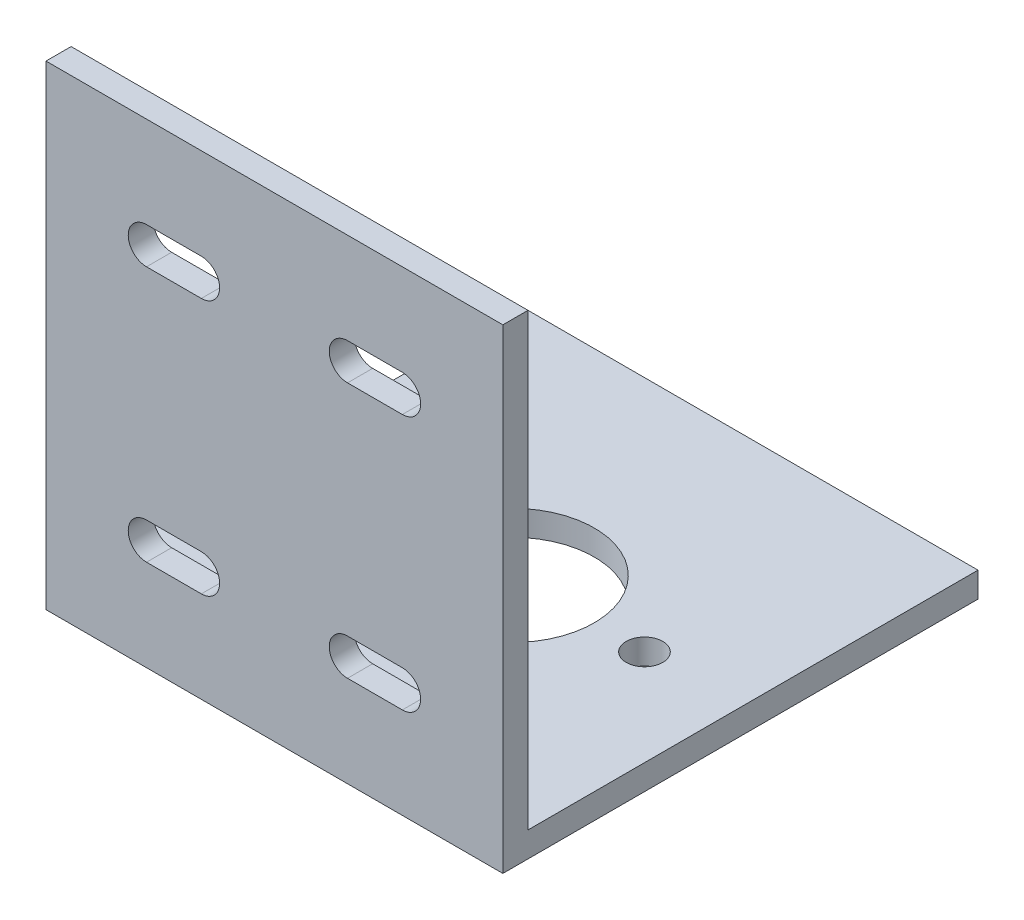
from build123d import *

# Parameters (mm, degrees)
SKETCH1_W           = 50
SKETCH1_H           = 52
SKETCH1_R           = 9
SKETCH1_R_2         = 2
BOSS_EXTRUDE1_DEPTH = 2.75
SKETCH2_W           = 50
SKETCH2_H           = 2.75
BOSS_EXTRUDE2_DEPTH = 52
CUT_EXTRUDE1_DEPTH  = 78.672388917


with BuildPart() as part:
    # Sketch1 → Boss-Extrude1 (new body)
    with BuildSketch(Plane(origin=(0, 0, 0), x_dir=(1, 0, 0), z_dir=(0, 1, 0))):
        Rectangle(SKETCH1_W, SKETCH1_H)
        with Locations(Location((0, 0, 0), (0, 0, 270))):
            Circle(SKETCH1_R, mode=Mode.SUBTRACT)
        with Locations(Location((-14.5, 0, 0), (0, 0, 270))):
            Circle(SKETCH1_R_2, mode=Mode.SUBTRACT)
        with Locations(Location((14.5, 0, 0), (0, 0, 270))):
            Circle(SKETCH1_R_2, mode=Mode.SUBTRACT)
    extrude(amount=BOSS_EXTRUDE1_DEPTH)

    # Sketch2 → Boss-Extrude2 (add)
    with BuildSketch(Plane(origin=(0, 0, 0), x_dir=(1, 0, 0), z_dir=(0, 1, 0))):
        with Locations((0, -24.625)):
            Rectangle(SKETCH2_W, SKETCH2_H)
    extrude(amount=BOSS_EXTRUDE2_DEPTH)

    # Sketch4 → Cut-Extrude1 (cut, through all)
    with BuildSketch(Plane.XY.offset(26)):
        with BuildLine():
            Line((-14, 14), (-8, 14))
            ThreePointArc((-8, 14), (-6, 12), (-8, 10))
            Line((-8, 10), (-14, 10))
            ThreePointArc((-14, 10), (-16, 12), (-14, 14))
        make_face()
        with BuildLine():
            Line((8, 14), (14, 14))
            ThreePointArc((14, 14), (16, 12), (14, 10))
            Line((14, 10), (8, 10))
            ThreePointArc((8, 10), (6, 12), (8, 14))
        make_face()
        with BuildLine():
            Line((8, 42), (14, 42))
            ThreePointArc((14, 42), (16, 40), (14, 38))
            Line((14, 38), (8, 38))
            ThreePointArc((8, 38), (6, 40), (8, 42))
        make_face()
        with BuildLine():
            Line((-14, 42), (-8, 42))
            ThreePointArc((-8, 42), (-6, 40), (-8, 38))
            Line((-8, 38), (-14, 38))
            ThreePointArc((-14, 38), (-16, 40), (-14, 42))
        make_face()
    extrude(amount=-CUT_EXTRUDE1_DEPTH, mode=Mode.SUBTRACT)


solid = part.part
